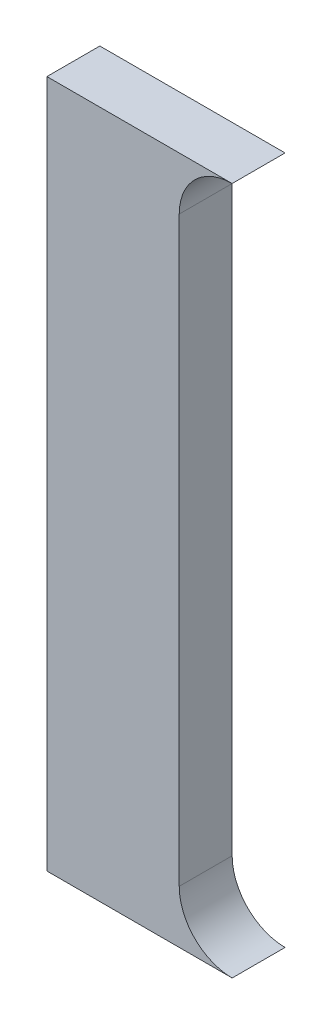
from build123d import *

# Parameters (mm, degrees)
SKETCH1_W           = 31.75
SKETCH1_H           = 165.1
BOSS_EXTRUDE1_DEPTH = 12.7
BOSS_EXTRUDE2_DEPTH = 12.7


with BuildPart() as part:
    # Sketch1 → Boss-Extrude1 (new body)
    with BuildSketch(Plane.XY):
        Rectangle(SKETCH1_W, SKETCH1_H)
    extrude(amount=BOSS_EXTRUDE1_DEPTH)

    # Sketch2 → Boss-Extrude2 (add)
    with BuildSketch(Plane.XY.offset(12.7)):
        with BuildLine():
            Line((15.875, 82.55), (28.575, 82.55))
            ThreePointArc((28.575, 82.55), (19.594743879, 78.830256121), (15.875, 69.85))
            Line((15.875, 69.85), (15.875, 82.55))
        make_face()
        with BuildLine():
            Line((15.875, -82.55), (15.875, -69.85))
            ThreePointArc((15.875, -69.85), (19.594743879, -78.830256121), (28.575, -82.55))
            Line((28.575, -82.55), (15.875, -82.55))
        make_face()
    extrude(amount=-BOSS_EXTRUDE2_DEPTH)


solid = part.part
